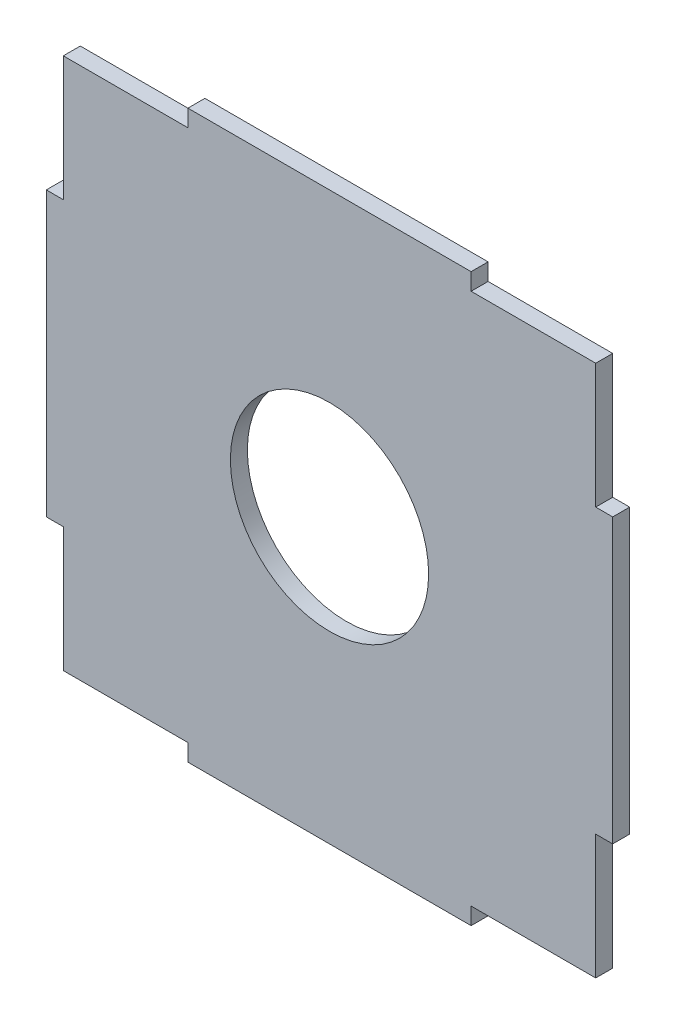
from build123d import *

# Parameters (mm, degrees)
EXTRUDE_1_DEPTH     = 3
SKETCH_2_R          = 17.5
CUT_EXTRUDE_1_DEPTH = 142.453172464


with BuildPart() as part:
    # 草图1 → 凸台-拉伸1 (new body)
    with BuildSketch(Plane.XY):
        Polygon((-75, 100), (-75, 97), (-97, 97), (-97, 75), (-100, 75), (-100, 25), (-97, 25), (-97, 3), (-75, 3), (-75, 0), (-25, 0), (-25, 3), (-3, 3), (-3, 25), (0, 25), (0, 75), (-3, 75), (-3, 97), (-25, 97), (-25, 100), align=None)
    extrude(amount=EXTRUDE_1_DEPTH)

    # 草图2 → 切除-拉伸1 (cut, through all)
    with BuildSketch(Plane(origin=(0, 0, 0), x_dir=(-1, 0, 0), z_dir=(0, 0, -1))):
        with Locations((50, 50)):
            Circle(SKETCH_2_R)
    extrude(amount=-CUT_EXTRUDE_1_DEPTH, mode=Mode.SUBTRACT)


solid = part.part
